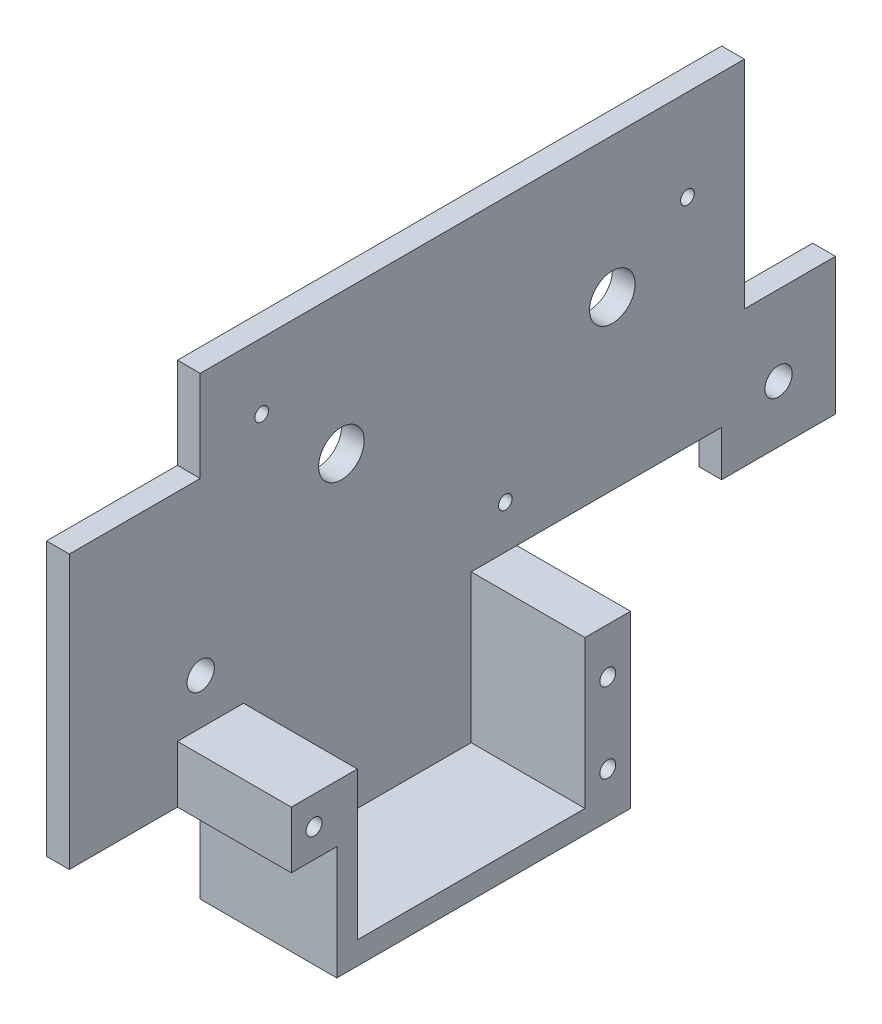
from build123d import *

# Parameters (mm, degrees)
SKETCH_1_W          = 28
SKETCH_1_H          = 13.5
EXTRUDE_1_DEPTH     = 1
SKETCH_2_R          = 0.3
CUT_EXTRUDE_1_DEPTH = 32.10064308
SKETCH_2_3_W        = 5
SKETCH_2_3_H        = 6
EXTRUDE_2_DEPTH     = 1
SKETCH_2_4_R        = 0.6
CUT_EXTRUDE_2_DEPTH = 33.019525293
SKETCH_3_R          = 1
CUT_EXTRUDE_3_DEPTH = 33.019525293
SKETCH_4_W          = 7
SKETCH_4_H          = 4
CUT_EXTRUDE_4_DEPTH = 1.5
SKETCH_5_R          = 0.6
CUT_EXTRUDE_5_DEPTH = 33.019525293
SKETCH_6_W          = 1
SKETCH_6_H          = 9.5
EXTRUDE_3_DEPTH     = 1
SKETCH_7_W          = 2
SKETCH_7_H          = 6.5
SKETCH_7_R          = 0.35
SKETCH_7_H_2        = 2.5
EXTRUDE_4_DEPTH     = 1
EXTRUDE_START       = 5
SKETCH_7_3_W        = 2
SKETCH_7_3_H        = 2.5
SKETCH_7_3_R        = 0.35
SKETCH_7_3_H_2      = 6.5
EXTRUDE_5_DEPTH     = 5
SKETCH_8_W          = 0.65
SKETCH_8_H          = 9.5
EXTRUDE_6_DEPTH     = 1


with BuildPart() as part:
    # 草图1 → 凸台-拉伸1 (new body)
    with BuildSketch(Plane(origin=(0, 0, 0), x_dir=(0, 0, -1), z_dir=(1, 0, 0))):
        with Locations((-14, -6.75)):
            Rectangle(SKETCH_1_W, SKETCH_1_H)
    extrude(amount=EXTRUDE_1_DEPTH)

    # 草图2 → 切除-拉伸1 (cut, through all)
    with BuildSketch(Plane(origin=(1, 0, 0), x_dir=(0, 0, -1), z_dir=(1, 0, 0))):
        with Locations((-1.5, -4)):
            Circle(SKETCH_2_R)
        with Locations((-20.2, -2.9)):
            Circle(SKETCH_2_R)
        with Locations((-9.5, -11.6)):
            Circle(SKETCH_2_R)
    extrude(amount=-CUT_EXTRUDE_1_DEPTH, mode=Mode.SUBTRACT)

    # 草图2<3> → 凸台-拉伸2 (add)
    with BuildSketch(Plane(origin=(1, 0, 0), x_dir=(0, 0, -1), z_dir=(1, 0, 0))):
        with Locations((2.5, -12.5)):
            Rectangle(SKETCH_2_3_W, SKETCH_2_3_H)
    extrude(amount=-EXTRUDE_2_DEPTH)

    # 草图2<4> → 切除-拉伸2 (cut, through all)
    with BuildSketch(Plane(origin=(1, 0, 0), x_dir=(0, 0, -1), z_dir=(1, 0, 0))):
        with Locations((2.5, -13)):
            Circle(SKETCH_2_4_R)
    extrude(amount=-CUT_EXTRUDE_2_DEPTH, mode=Mode.SUBTRACT)

    # 草图3 → 切除-拉伸3 (cut, through all)
    with BuildSketch(Plane(origin=(1, 0, 0), x_dir=(0, 0, -1), z_dir=(1, 0, 0))):
        with Locations((-4.8, -6.15)):
            Circle(SKETCH_3_R)
        with Locations((-16.7, -6.15)):
            Circle(SKETCH_3_R)
    extrude(amount=-CUT_EXTRUDE_3_DEPTH, mode=Mode.SUBTRACT)

    # 草图4 → 切除-拉伸4 (cut)
    with BuildSketch(Plane(origin=(1, 0, 0), x_dir=(0, 0, -1), z_dir=(1, 0, 0))):
        with Locations((-26.4, -2)):
            Rectangle(SKETCH_4_W, SKETCH_4_H)
    extrude(amount=-CUT_EXTRUDE_4_DEPTH, mode=Mode.SUBTRACT)

    # 草图5 → 切除-拉伸5 (cut, through all)
    with BuildSketch(Plane.ZY):
        with Locations((22.880658046, -11.5)):
            Circle(SKETCH_5_R)
    extrude(amount=-CUT_EXTRUDE_5_DEPTH, mode=Mode.SUBTRACT)

    # 草图6 → 凸台-拉伸3 (add)
    with BuildSketch(Plane(origin=(1, 0, 0), x_dir=(0, 0, -1), z_dir=(1, 0, 0))):
        with Locations((0.5, -4.75)):
            Rectangle(SKETCH_6_W, SKETCH_6_H)
    extrude(amount=-EXTRUDE_3_DEPTH)

    # 草图7 → 凸台-拉伸4 (add)
    # profile 1 of 5: a face of its own
    with BuildSketch(Plane(origin=(1, 0, 0), x_dir=(0, 0, -1), z_dir=(1, 0, 0))):
        Polygon((-11, -13.5), (-11, -10), (-21, -10), (-21, -13.5), (-21, -20), (-11, -20), align=None)
    # profile 2 of 5: a face of its own
    with BuildSketch(Plane(origin=(1, 0, 0), x_dir=(0, 0, -1), z_dir=(1, 0, 0))):
        with Locations((-10, -16.75)):
            Rectangle(SKETCH_7_W, SKETCH_7_H)
        with Locations((-10, -19)):
            Circle(SKETCH_7_R, mode=Mode.SUBTRACT)
        with Locations((-10, -15.5)):
            Circle(SKETCH_7_R, mode=Mode.SUBTRACT)
    # profile 3 of 5: a face of its own
    with BuildSketch(Plane(origin=(1, 0, 0), x_dir=(0, 0, -1), z_dir=(1, 0, 0))):
        Polygon((-21, -20), (-21, -13.5), (-21.9, -13.5), (-21.9, -16), (-21.9, -21), (-21, -21), align=None)
    # profile 4 of 5: a face of its own
    with BuildSketch(Plane(origin=(1, 0, 0), x_dir=(0, 0, -1), z_dir=(1, 0, 0))):
        Polygon((-9, -20), (-11, -20), (-21, -20), (-21, -21), (-9, -21), align=None)
    # profile 5 of 5: a face of its own
    with BuildSketch(Plane(origin=(1, 0, 0), x_dir=(0, 0, -1), z_dir=(1, 0, 0))):
        with Locations((-22.9, -14.75)):
            Rectangle(SKETCH_7_W, SKETCH_7_H_2)
        with Locations((-22.9, -14.75)):
            Circle(SKETCH_7_R, mode=Mode.SUBTRACT)
    extrude(amount=-EXTRUDE_4_DEPTH)

    # 草图7<3> → 凸台-拉伸5 (add)
    # profile 1 of 4: a face of its own
    with BuildSketch(Plane(origin=(1, 0, 0), x_dir=(0, 0, -1), z_dir=(1, 0, 0)).offset(EXTRUDE_START)):
        Polygon((-21, -20), (-21, -13.5), (-21.9, -13.5), (-21.9, -16), (-21.9, -21), (-21, -21), align=None)
    # profile 2 of 4: a face of its own
    with BuildSketch(Plane(origin=(1, 0, 0), x_dir=(0, 0, -1), z_dir=(1, 0, 0)).offset(EXTRUDE_START)):
        with Locations((-22.9, -14.75)):
            Rectangle(SKETCH_7_3_W, SKETCH_7_3_H)
        with Locations((-22.9, -14.75)):
            Circle(SKETCH_7_3_R, mode=Mode.SUBTRACT)
    # profile 3 of 4: a face of its own
    with BuildSketch(Plane(origin=(1, 0, 0), x_dir=(0, 0, -1), z_dir=(1, 0, 0)).offset(EXTRUDE_START)):
        Polygon((-9, -20), (-9, -21), (-21, -21), (-21, -20), (-11, -20), align=None)
    # profile 4 of 4: a face of its own
    with BuildSketch(Plane(origin=(1, 0, 0), x_dir=(0, 0, -1), z_dir=(1, 0, 0)).offset(EXTRUDE_START)):
        with Locations((-10, -16.75)):
            Rectangle(SKETCH_7_3_W, SKETCH_7_3_H_2)
        with Locations((-10, -19)):
            Circle(SKETCH_7_3_R, mode=Mode.SUBTRACT)
        with Locations((-10, -15.5)):
            Circle(SKETCH_7_3_R, mode=Mode.SUBTRACT)
    extrude(amount=-EXTRUDE_5_DEPTH)

    # 草图8 → 凸台-拉伸6 (add)
    with BuildSketch(Plane(origin=(1, 0, 0), x_dir=(0, 0, -1), z_dir=(1, 0, 0))):
        with Locations((-28.325, -8.75)):
            Rectangle(SKETCH_8_W, SKETCH_8_H)
        Polygon((-28.65, -16), (-23.9, -16), (-23.9, -13.5), (-28, -13.5), (-28.65, -13.5), align=None)
    extrude(amount=-EXTRUDE_6_DEPTH)


solid = part.part
